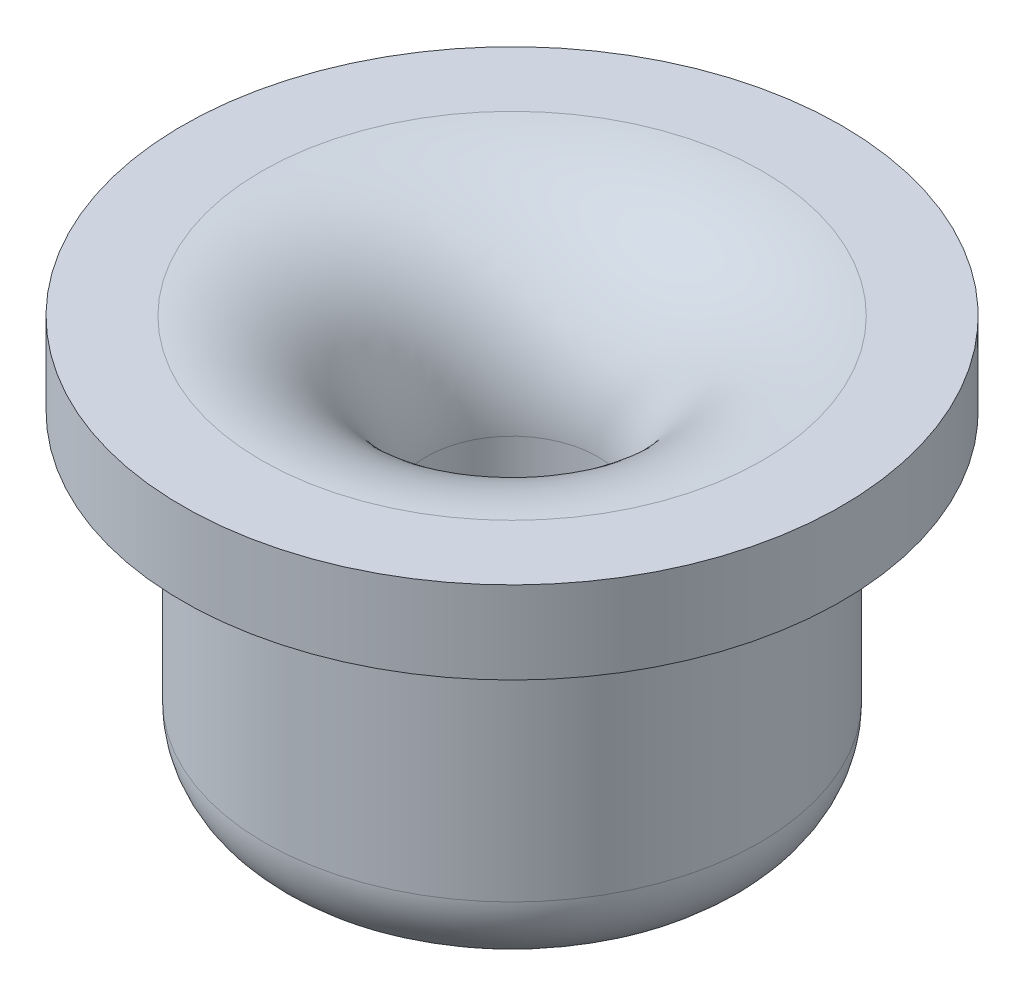
from build123d import *

# Parameters (mm, degrees)
FILLET1_R = 3.175
FILLET4_R = 1.524


with BuildPart() as part:
    # Sketch1 → Revolve1 (revolve)
    with BuildSketch(Plane(origin=(0, 0, 0), x_dir=(0, 0, -1), z_dir=(1, 0, 0)), mode=Mode.PRIVATE) as revolve1_sk:
        Polygon((-1.651, 0), (-1.651, 7.9375), (-6.35, 7.9375), (-6.35, 6.35), (-4.7625, 6.35), (-4.7625, 0), align=None)
    revolve(revolve1_sk.sketch.rotate(Axis((0, 0, 0), (0, 1, 0)), 180), axis=Axis((0, 0, 0), (0, 1, 0)))

    # Fillet1
    fillet1_edges = [part.edges().sort_by_distance(p)[0] for p in [
        (0, 7.9375, 1.651),
    ]]
    fillet(fillet1_edges, radius=FILLET1_R)

    # Fillet4
    fillet4_edges = [part.edges().sort_by_distance(p)[0] for p in [
        (0, 0, 4.7625),
        (0, 0, 1.651),
    ]]
    fillet(fillet4_edges, radius=FILLET4_R)


solid = part.part
